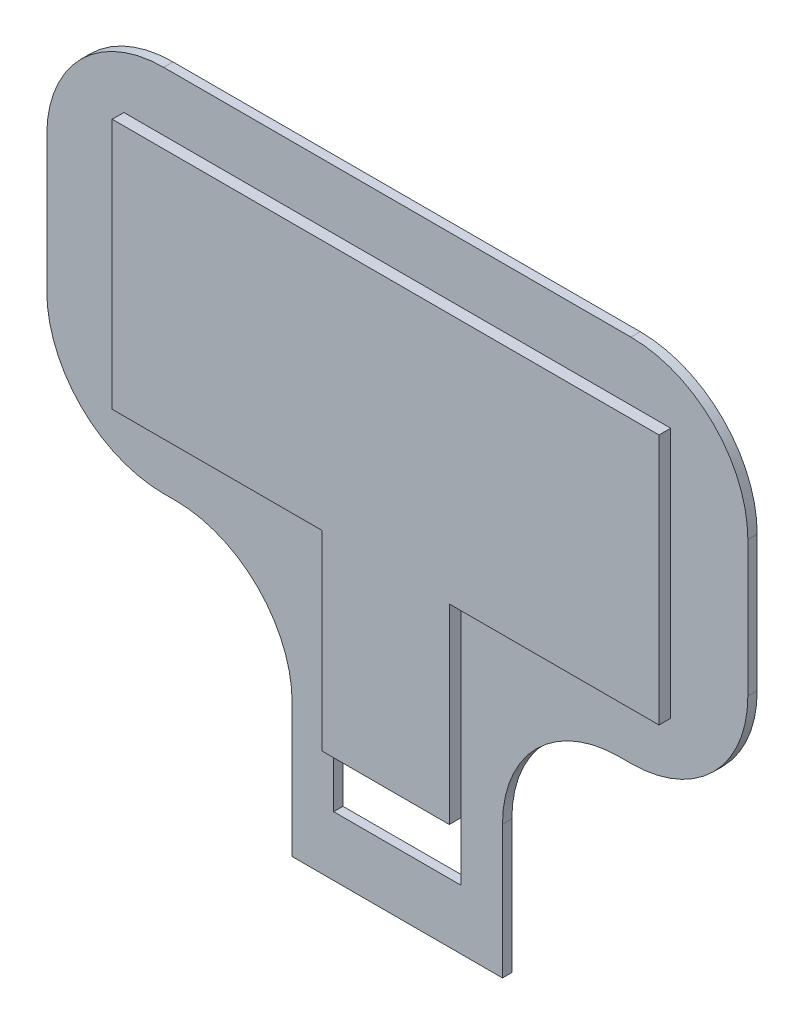
from build123d import *

# Parameters (mm, degrees)
SKETCH1_W           = 60
SKETCH1_H           = 53
BOSS_EXTRUDE1_DEPTH = 0.8
CUT_EXTRUDE2_DEPTH  = 0.8
SKETCH3_W           = 10.9
SKETCH3_H           = 21.35
SKETCH3_W_2         = 46.8
SKETCH3_H_2         = 21.5
BOSS_EXTRUDE2_DEPTH = 1
SKETCH4_W           = 10.9
SKETCH4_H           = 5
CUT_EXTRUDE3_DEPTH  = 10


with BuildPart() as part:
    # Sketch1 → Boss-Extrude1 (new body)
    with BuildSketch(Plane.XY):
        with Locations((30, 26.5)):
            Rectangle(SKETCH1_W, SKETCH1_H)
    extrude(amount=BOSS_EXTRUDE1_DEPTH)

    # Sketch2 → Cut-Extrude2 (cut)
    with BuildSketch(Plane.XY.offset(0.8)):
        with BuildLine():
            ThreePointArc((0, 43), (2.928932188, 50.071067812), (10, 53))
            Line((10, 53), (0, 53))
            Line((0, 53), (0, 43))
        make_face()
        with BuildLine():
            ThreePointArc((10, 21.4), (2.928932188, 24.328932188), (0, 31.4))
            Line((0, 31.4), (0, 0))
            Line((0, 0), (21, 0))
            Line((21, 0), (21, 11.4))
            ThreePointArc((21, 11.4), (18.071067812, 18.471067812), (11, 21.4))
            Line((11, 21.4), (10, 21.4))
        make_face()
        with BuildLine():
            Line((60, 0), (60, 31.4))
            ThreePointArc((60, 31.4), (57.071067812, 24.328932188), (50, 21.4))
            Line((50, 21.4), (49, 21.4))
            ThreePointArc((49, 21.4), (41.928932188, 18.471067812), (39, 11.4))
            Line((39, 11.4), (39, 0))
            Line((39, 0), (60, 0))
        make_face()
        with BuildLine():
            Line((60, 53), (50, 53))
            ThreePointArc((50, 53), (57.071067812, 50.071067812), (60, 43))
            Line((60, 43), (60, 53))
        make_face()
    extrude(amount=-CUT_EXTRUDE2_DEPTH, mode=Mode.SUBTRACT)

    # Sketch3 → Boss-Extrude2 (add)
    with BuildSketch(Plane.XY.offset(0.8)):
        with Locations((30, 15.775)):
            Rectangle(SKETCH3_W, SKETCH3_H)
        with Locations((30, 37.2)):
            Rectangle(SKETCH3_W_2, SKETCH3_H_2)
    extrude(amount=BOSS_EXTRUDE2_DEPTH)

    # Sketch4 → Cut-Extrude3 (cut)
    with BuildSketch(Plane.XY.offset(1.8)):
        with Locations((30, 7.6)):
            Rectangle(SKETCH4_W, SKETCH4_H)
    extrude(amount=-CUT_EXTRUDE3_DEPTH, mode=Mode.SUBTRACT)


solid = part.part
